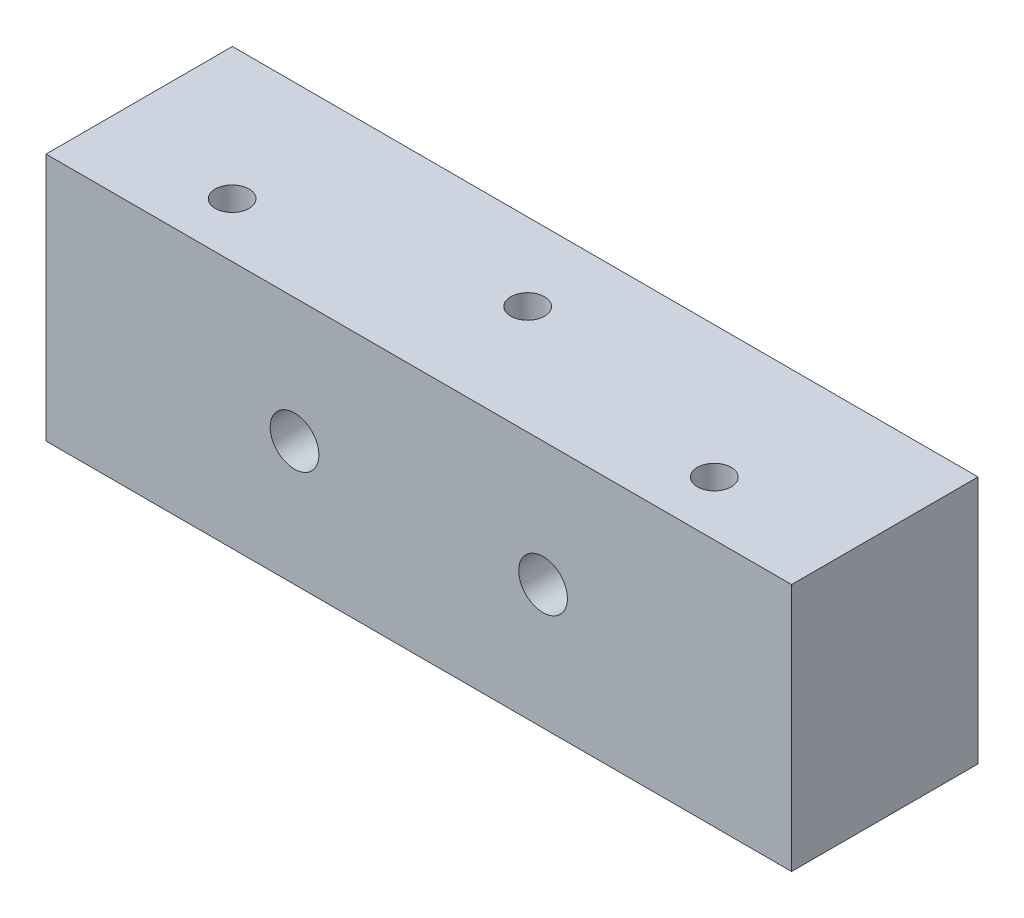
from build123d import *

# Parameters (mm, degrees)
SKETCH1_W              = 76.2
SKETCH1_H              = 19.05
BOSS_EXTRUDE1_DEPTH    = 12.7
F_8_32_TAPPED_HOLE1_D  = 3.4544
F_10_CLEARANCE_HOLE1_D = 4.9784


with BuildPart() as part:
    # Sketch1 → Boss-Extrude1 (new, symmetric)
    with BuildSketch(Plane(origin=(0, 0, 0), x_dir=(1, 0, 0), z_dir=(0, 1, 0))):
        Rectangle(SKETCH1_W, SKETCH1_H)
    extrude(amount=BOSS_EXTRUDE1_DEPTH, both=True)

    # #8-32 Tapped Hole1 (through all)
    with Locations(Plane(origin=(-24.638, -12.7, 3.9624), x_dir=(0, 0, -1), z_dir=(0, -1, 0))):
        with Locations((0, 0), (5.5626, 24.638), (0, 49.276)):
            Hole(F_8_32_TAPPED_HOLE1_D / 2)

    # #10 Clearance Hole1 (through all)
    with Locations(Plane(origin=(0, 0, -9.525), x_dir=(-1, 0, 0), z_dir=(0, 0, -1))):
        with Locations((-12.7, 0), (12.7, 0)):
            Hole(F_10_CLEARANCE_HOLE1_D / 2)


solid = part.part
